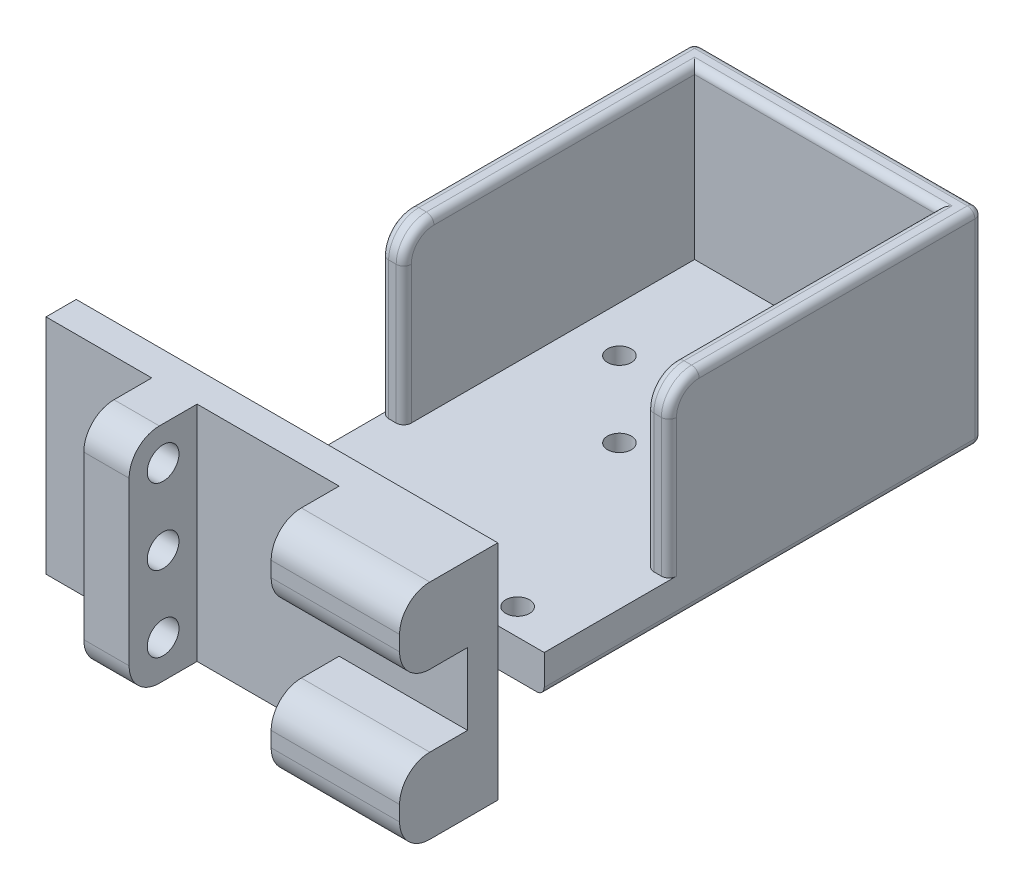
from build123d import *

# Parameters (mm, degrees)
SKETCH_1_W          = 38.1
SKETCH_1_H          = 44
SENSOR_BASE_DEPTH   = 5
PROTECTOR_DEPTH     = 22.2
SKETCH_4_R          = 1.575
CUT_EXTRUDE_1_DEPTH = 37.602493084
SKETCH_5_W          = 38.1
SKETCH_5_H          = 5
EXTRUDE_3_DEPTH     = 29
EXTRUDE_4_DEPTH     = 4
SKETCH_9_W          = 6
SKETCH_9_H          = 29.5
EXTRUDE_5_DEPTH     = 9
SKETCH_10_W         = 17
SKETCH_10_H         = 10
EXTRUDE_6_DEPTH     = 9
FILLET_2_R          = 4
FILLET_3_R          = 4
FILLET_4_R          = 4
FILLET_5_R          = 4
FILLET_6_R          = 4
CUT_EXTRUDE_6_REACH = 83.936
SKETCH_26_R         = 2.1
SKETCH_30_W         = 14.05
SKETCH_30_H         = 8
CUT_EXTRUDE_7_DEPTH = 5
CUT_EXTRUDE_8_REACH = 75.991
SKETCH_31_R         = 1.575
FILLET_7_R          = 1
FILLET_8_R          = 1
FILLET_9_R          = 1


with BuildPart() as part:
    # 草图1 → Sensor_base (new body)
    with BuildSketch(Plane(origin=(0, 0, 0), x_dir=(1, 0, 0), z_dir=(0, 1, 0))):
        Rectangle(SKETCH_1_W, SKETCH_1_H)
    extrude(amount=SENSOR_BASE_DEPTH)

    # 草图2 → Protector (add)
    with BuildSketch(Plane(origin=(0, 5, 0), x_dir=(1, 0, 0), z_dir=(0, 1, 0))):
        Polygon((-19.05, 22), (-19.05, -19.5), (-16.05, -19.5), (-16.05, 19), (16.05, 19), (16.05, -19.5), (19.05, -19.5), (19.05, 18), (19.05, 22), align=None)
    extrude(amount=PROTECTOR_DEPTH)

    # 草图4 → 切除-拉伸1 (cut, through all)
    with BuildSketch(Plane(origin=(0, 5, 0), x_dir=(1, 0, 0), z_dir=(0, 1, 0))):
        with Locations(Location((0, 13, 0), (0, 0, 270))):
            Circle(SKETCH_4_R)
        with Locations(Location((-10, 3, 0), (0, 0, 270))):
            Circle(SKETCH_4_R)
        with Locations(Location((10, 3, 0), (0, 0, 270))):
            Circle(SKETCH_4_R)
        with Locations(Location((0, -7, 0), (0, 0, 270))):
            Circle(SKETCH_4_R)
    extrude(amount=-CUT_EXTRUDE_1_DEPTH, mode=Mode.SUBTRACT)

    # 草图5 → 凸台-拉伸3 (add)
    with BuildSketch(Plane.XY.offset(22)):
        with Locations((0, 2.5)):
            Rectangle(SKETCH_5_W, SKETCH_5_H)
    extrude(amount=EXTRUDE_3_DEPTH)

    # 草图8 → 凸台-拉伸4 (add)
    with BuildSketch(Plane.XY.offset(51)):
        Polygon((0, 0), (-27.9, 0), (-27.9, 29.5), (27.9, 29.5), (27.9, 0), align=None)
    extrude(amount=EXTRUDE_4_DEPTH)

    # 草图9 → 凸台-拉伸5 (add)
    with BuildSketch(Plane.XY.offset(55)):
        with Locations((-10.9, 14.75)):
            Rectangle(SKETCH_9_W, SKETCH_9_H)
    extrude(amount=EXTRUDE_5_DEPTH)

    # 草图10 → 凸台-拉伸6 (add)
    with BuildSketch(Plane.XY.offset(55)):
        with Locations((19.4, 24.5)):
            Rectangle(SKETCH_10_W, SKETCH_10_H)
        with Locations((19.4, 5)):
            Rectangle(SKETCH_10_W, SKETCH_10_H)
    extrude(amount=EXTRUDE_6_DEPTH)

    # 圆角2
    fillet_2_edges = [part.edges().sort_by_distance(p)[0] for p in [
        (19.4, 29.5, 64),
    ]]
    fillet(fillet_2_edges, radius=FILLET_2_R)

    # 圆角3
    fillet_3_edges = [part.edges().sort_by_distance(p)[0] for p in [
        (19.4, 19.5, 64),
    ]]
    fillet(fillet_3_edges, radius=FILLET_3_R)

    # 圆角4
    fillet_4_edges = [part.edges().sort_by_distance(p)[0] for p in [
        (19.4, 0, 64),
        (19.4, 10, 64),
    ]]
    fillet(fillet_4_edges, radius=FILLET_4_R)

    # 圆角5
    fillet_5_edges = [part.edges().sort_by_distance(p)[0] for p in [
        (-10.9, 0, 64),
        (-10.9, 29.5, 64),
    ]]
    fillet(fillet_5_edges, radius=FILLET_5_R)

    # 圆角6
    fillet_6_edges = [part.edges().sort_by_distance(p)[0] for p in [
        (-17.55, 27.2, 19.5),
        (17.55, 27.2, 19.5),
    ]]
    fillet(fillet_6_edges, radius=FILLET_6_R)

    # 草图26 → 切除-拉伸6 (cut, up to next)
    with BuildSketch(Plane.ZY.offset(13.9), mode=Mode.PRIVATE) as cut_extrude_6_sk1:
        with Locations(Location((59.5, 5, 0), (0, 0, 270))):
            Circle(SKETCH_26_R)
    cut_extrude_6_tool1 = extrude(cut_extrude_6_sk1.sketch, amount=-CUT_EXTRUDE_6_REACH, mode=Mode.PRIVATE) & part.part
    # 草图26 → 切除-拉伸6 (cut, up to next)
    with BuildSketch(Plane.ZY.offset(13.9), mode=Mode.PRIVATE) as cut_extrude_6_sk2:
        with Locations(Location((59.5, 15, 0), (0, 0, 270))):
            Circle(SKETCH_26_R)
    cut_extrude_6_tool2 = extrude(cut_extrude_6_sk2.sketch, amount=-CUT_EXTRUDE_6_REACH, mode=Mode.PRIVATE) & part.part
    # 草图26 → 切除-拉伸6 (cut, up to next)
    with BuildSketch(Plane.ZY.offset(13.9), mode=Mode.PRIVATE) as cut_extrude_6_sk3:
        with Locations(Location((59.5, 25, 0), (0, 0, 270))):
            Circle(SKETCH_26_R)
    cut_extrude_6_tool3 = extrude(cut_extrude_6_sk3.sketch, amount=-CUT_EXTRUDE_6_REACH, mode=Mode.PRIVATE) & part.part
    add(cut_extrude_6_tool1.solids().sort_by_distance((-13.9, 5, 59.5))[0], mode=Mode.SUBTRACT)
    add(cut_extrude_6_tool2.solids().sort_by_distance((-13.9, 15, 59.5))[0], mode=Mode.SUBTRACT)
    add(cut_extrude_6_tool3.solids().sort_by_distance((-13.9, 25, 59.5))[0], mode=Mode.SUBTRACT)

    # 草图30 → 切除-拉伸7 (cut)
    with BuildSketch(Plane(origin=(0, 5, 0), x_dir=(1, 0, 0), z_dir=(0, 1, 0))):
        Polygon((0, -44), (5, -44), (5, -36), (-5, -36), (-5, -44), align=None)
        with Locations((12.025, -40)):
            Rectangle(SKETCH_30_W, SKETCH_30_H)
    extrude(amount=-CUT_EXTRUDE_7_DEPTH, mode=Mode.SUBTRACT)

    # 草图31 → 切除-拉伸8 (cut, up to next)
    with BuildSketch(Plane(origin=(0, 5, 0), x_dir=(1, 0, 0), z_dir=(0, 1, 0)), mode=Mode.PRIVATE) as cut_extrude_8_sk1:
        with Locations(Location((12.025, -32.5, 0), (0, 0, 270))):
            Circle(SKETCH_31_R)
    cut_extrude_8_tool1 = extrude(cut_extrude_8_sk1.sketch, amount=-CUT_EXTRUDE_8_REACH, mode=Mode.PRIVATE) & part.part
    # 草图31 → 切除-拉伸8 (cut, up to next)
    with BuildSketch(Plane(origin=(0, 5, 0), x_dir=(1, 0, 0), z_dir=(0, 1, 0)), mode=Mode.PRIVATE) as cut_extrude_8_sk2:
        with Locations(Location((12.025, -47.5, 0), (0, 0, 270))):
            Circle(SKETCH_31_R)
    cut_extrude_8_tool2 = extrude(cut_extrude_8_sk2.sketch, amount=-CUT_EXTRUDE_8_REACH, mode=Mode.PRIVATE) & part.part
    add(cut_extrude_8_tool1.solids().sort_by_distance((12.025, 5, 32.5))[0], mode=Mode.SUBTRACT)
    add(cut_extrude_8_tool2.solids().sort_by_distance((12.025, 5, 47.5))[0], mode=Mode.SUBTRACT)

    # 圆角7
    fillet_7_edges = [part.edges().sort_by_distance(p)[0] for p in [
        (19.05, 13.6, -22),
    ]]
    fillet(fillet_7_edges, radius=FILLET_7_R)

    # 圆角8
    fillet_8_edges = [part.edges().sort_by_distance(p)[0] for p in [
        (19.05, 0, 7.5),
        (-0.5, 0, -22),
        (18.757106781, 0, -21.707106781),
        (-19.05, 0, 14.5),
        (-19.05, 13.6, -22),
    ]]
    fillet(fillet_8_edges, radius=FILLET_8_R)

    # 圆角9
    fillet_9_edges = [part.edges().sort_by_distance(p)[0] for p in [
        (-16.05, 27.2, -1.75),
        (19.05, 27.2, -2.75),
        (-16.05, 14.1, 19.5),
        (-16.05, 26.028427125, 18.328427125),
        (-19.05, 14.1, 19.5),
        (-19.05, 26.028427125, 18.328427125),
        (19.05, 14.1, 19.5),
        (19.05, 26.028427125, 18.328427125),
        (16.05, 14.1, 19.5),
        (16.05, 26.028427125, 18.328427125),
        (0, 27.2, -19),
        (16.05, 27.2, -1.75),
        (0, 27.2, -22),
        (18.757106781, 27.2, -21.707106781),
        (-19.05, 27.2, -2.75),
        (-18.757106781, 27.2, -21.707106781),
    ]]
    fillet(fillet_9_edges, radius=FILLET_9_R)


solid = part.part
